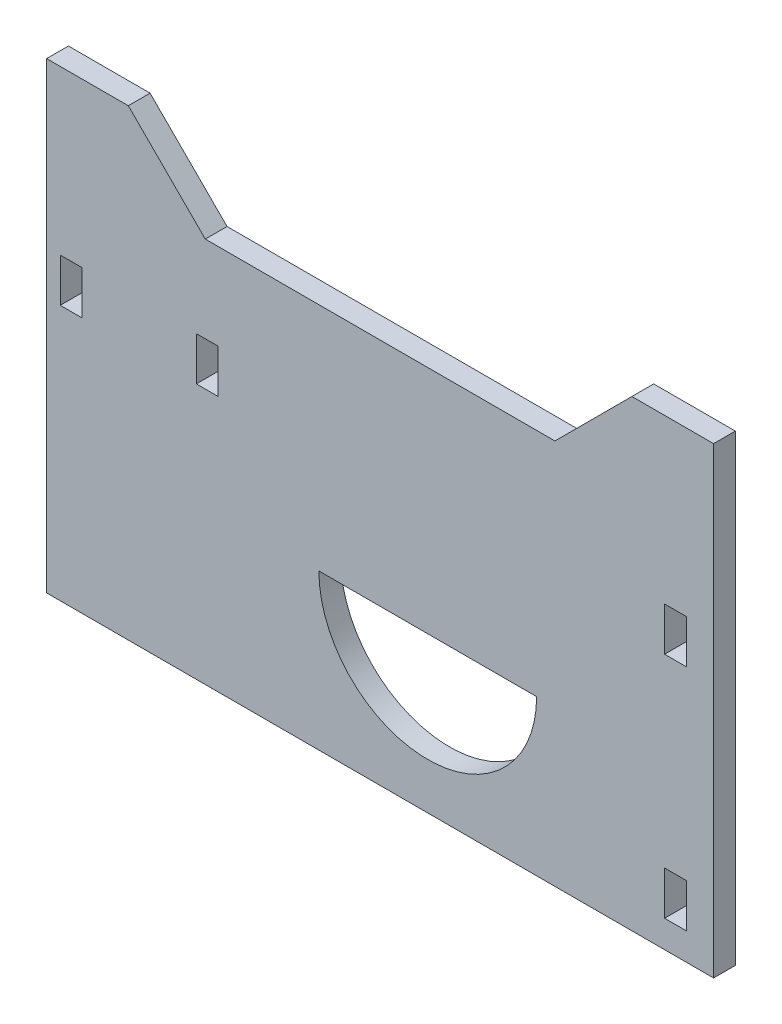
from build123d import *

# Parameters (mm, degrees)
SKETCH1_W           = 122.5
SKETCH1_H           = 60
SKETCH1_W_2         = 4
SKETCH1_H_2         = 8
BOSS_EXTRUDE1_DEPTH = 4
BOSS_EXTRUDE2_DEPTH = 4


with BuildPart() as part:
    # Sketch1 → Boss-Extrude1 (new body)
    with BuildSketch(Plane.XY):
        with Locations((-8.75, 0)):
            Rectangle(SKETCH1_W, SKETCH1_H)
        with BuildLine():
            Line((-20, -1.498357325), (20, -1.498357325))
            ThreePointArc((20, -1.498357325), (0, -21.498357325), (-20, -1.498357325))
        make_face(mode=Mode.SUBTRACT)
        with Locations((-40.5, 21)):
            Rectangle(SKETCH1_W_2, SKETCH1_H_2, mode=Mode.SUBTRACT)
        with Locations((45.5, 21)):
            Rectangle(SKETCH1_W_2, SKETCH1_H_2, mode=Mode.SUBTRACT)
        with Locations((45.5, -21)):
            Rectangle(SKETCH1_W_2, SKETCH1_H_2, mode=Mode.SUBTRACT)
        with Locations((-65.5, 21)):
            Rectangle(SKETCH1_W_2, SKETCH1_H_2, mode=Mode.SUBTRACT)
    extrude(amount=BOSS_EXTRUDE1_DEPTH)

    # Sketch2 → Boss-Extrude2 (add)
    with BuildSketch(Plane.XY):
        Polygon((-70, 30), (52.5, 30), (52.5, 55), (37.5, 55), (23.357864376, 40.857864376), (-40.857864376, 40.857864376), (-55, 55), (-70, 55), align=None)
    extrude(amount=BOSS_EXTRUDE2_DEPTH)


solid = part.part
